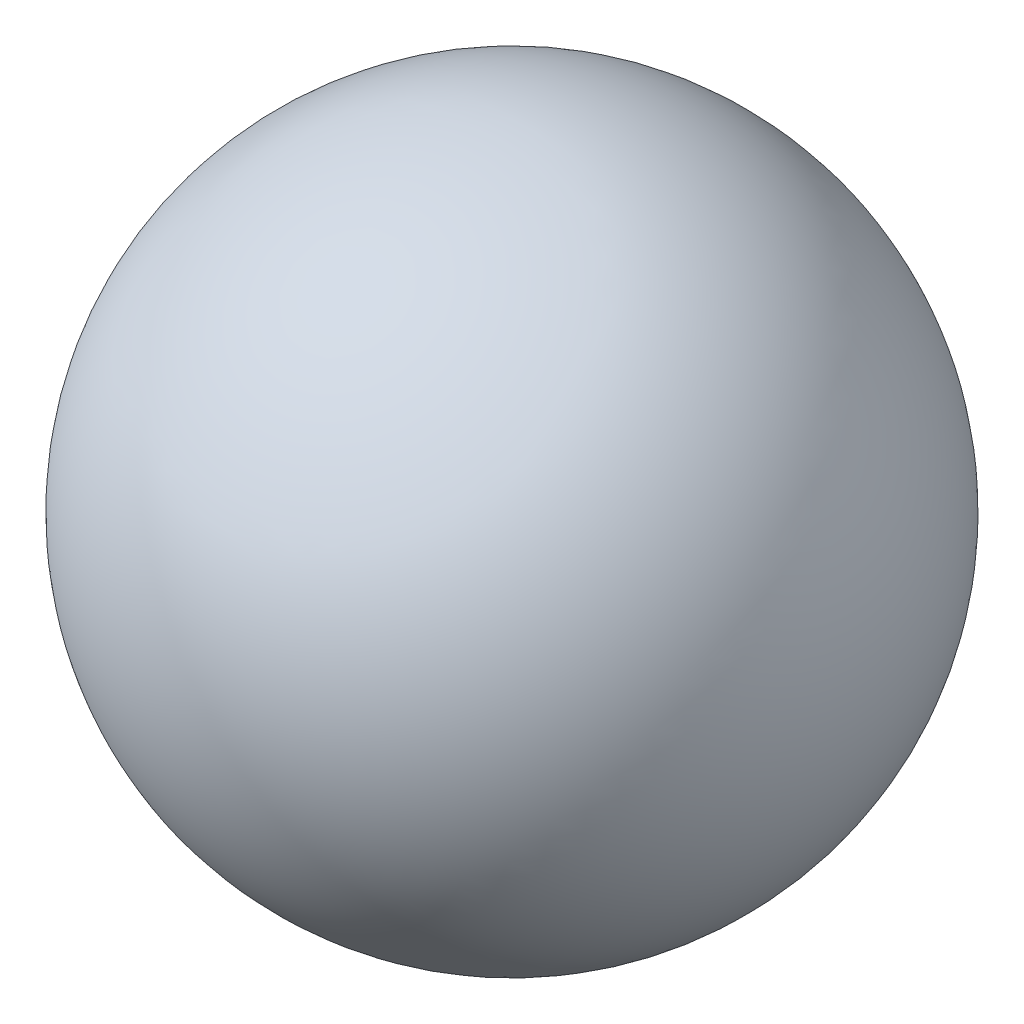
from build123d import *


with BuildPart() as part:
    # Sketch1 → Revolve2 (revolve)
    with BuildSketch(Plane(origin=(0, 0, 0), x_dir=(1, 0, 0), z_dir=(0, 1, 0))):
        with BuildLine():
            Line((0, 0.625), (0, -0.625))
            ThreePointArc((0, -0.625), (0.625, 0), (0, 0.625))
        make_face()
    revolve(axis=Axis((0, 0, -1.551649696), (0, 0, 1)))


solid = part.part
